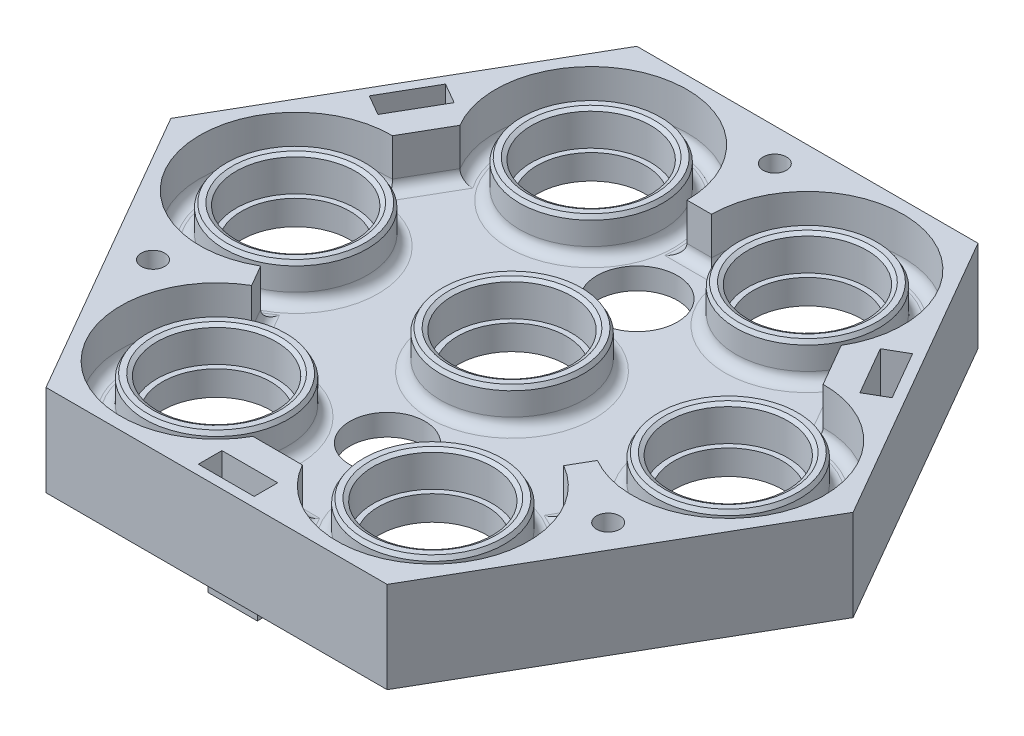
from build123d import *
from OCP.BRepFilletAPI import BRepFilletAPI_MakeChamfer

# Parameters (mm, degrees)
BOSS_EXTRUDE1_DEPTH = 28.05
BOSS_EXTRUDE2_START = -4.004
SKETCH3_R           = 10.1
BOSS_EXTRUDE2_DEPTH = 4.004
SKETCH3_3_R         = 11.1
SKETCH3_3_R_2       = 10.1
BOSS_EXTRUDE3_DEPTH = 0.6
SKETCH3_4_R         = 13.35
SKETCH3_4_R_2       = 11.1
BOSS_EXTRUDE4_DEPTH = 7
CHAMFER1_SIZE       = 0.75
CHAMFER1_SIZE2      = 0.433012702
SKETCH4_W           = 9.20093346
SKETCH4_H           = 3
BOSS_EXTRUDE5_DEPTH = 4
SKETCH5_R           = 2.175
CUT_EXTRUDE1_DEPTH  = 16.25
FILLET2_R           = 2
FILLET3_R           = 2
CUT_EXTRUDE2_DEPTH  = 87.445405368
SKETCH7_R           = 2.175
CUT_EXTRUDE3_DEPTH  = 11.05
SKETCH8_W           = 10.4
SKETCH8_H           = 4.4
CUT_EXTRUDE4_DEPTH  = 11


with BuildPart() as part:
    # Sketch1 → Boss-Extrude1 (new body)
    with BuildSketch(Plane(origin=(0, 0, 0), x_dir=(1, 0, 0), z_dir=(0, 1, 0))):
        with BuildLine():
            ThreePointArc((4.598585794, -43.670987935), (15.441921389, -52.121912551), (29.0763555, -50.361725025))
            Line((29.0763555, -50.361725025), (31.782668218, -55.049196153))
            Line((31.782668218, -55.049196153), (-31.782668218, -55.049196153))
            Line((-31.782668218, -55.049196153), (-63.565336435, 0))
            Line((-63.565336435, 0), (-58.152711, 0))
            ThreePointArc((-58.152711, 0), (-49.22575975, -15.461933122), (-31.37185725, -15.461933122))
            Line((-31.37185725, -15.461933122), (-29.0763555, -19.437858782))
            ThreePointArc((-29.0763555, -19.437858782), (-32.710456807, -47.587651973), (-4.598585794, -43.670987935))
            Line((-4.598585794, -43.670987935), (4.598585794, -43.670987935))
        make_face()
        with BuildLine():
            ThreePointArc((-40.119477858, 17.853001848), (-52.859861057, 12.687860069), (-58.152711, 0))
            Line((-58.152711, 0), (-63.565336435, 0))
            Line((-63.565336435, 0), (-31.782668218, 55.049196153))
            Line((-31.782668218, 55.049196153), (31.782668218, 55.049196153))
            Line((31.782668218, 55.049196153), (29.0763555, 50.361725025))
            ThreePointArc((29.0763555, 50.361725025), (11.222453, 50.361725025), (2.29550175, 34.899791903))
            Line((2.29550175, 34.899791903), (-2.29550175, 34.899791903))
            ThreePointArc((-2.29550175, 34.899791903), (-24.856887111, 52.121912551), (-35.520892063, 25.817986087))
            Line((-35.520892063, 25.817986087), (-40.119477858, 17.853001848))
        make_face()
        with BuildLine():
            ThreePointArc((35.520892063, 25.817986087), (37.417939668, 39.434052481), (29.0763555, 50.361725025))
            Line((29.0763555, 50.361725025), (31.782668218, 55.049196153))
            Line((31.782668218, 55.049196153), (63.565336435, 0))
            Line((63.565336435, 0), (31.782668218, -55.049196153))
            Line((31.782668218, -55.049196153), (29.0763555, -50.361725025))
            ThreePointArc((29.0763555, -50.361725025), (38.00330675, -34.899791903), (29.0763555, -19.437858782))
            Line((29.0763555, -19.437858782), (31.37185725, -15.461933122))
            ThreePointArc((31.37185725, -15.461933122), (57.567343918, -4.534260578), (40.119477858, 17.853001848))
            Line((40.119477858, 17.853001848), (35.520892063, 25.817986087))
        make_face()
    extrude(amount=-BOSS_EXTRUDE1_DEPTH)

    # Sketch3 → Boss-Extrude2 (add)
    with BuildSketch(Plane(origin=(0, -20.046, 0), x_dir=(1, 0, 0), z_dir=(0, 1, 0)).offset(BOSS_EXTRUDE2_START)):
        with BuildLine():
            Line((-31.37185725, -15.461933122), (-29.0763555, -19.437858782))
            ThreePointArc((-29.0763555, -19.437858782), (-32.710456807, -47.587651973), (-4.598585794, -43.670987935))
            Line((-4.598585794, -43.670987935), (4.598585794, -43.670987935))
            ThreePointArc((4.598585794, -43.670987935), (32.710456807, -47.587651973), (29.0763555, -19.437858782))
            Line((29.0763555, -19.437858782), (31.37185725, -15.461933122))
            ThreePointArc((31.37185725, -15.461933122), (57.567343918, -4.534260578), (40.119477858, 17.853001848))
            Line((40.119477858, 17.853001848), (35.520892063, 25.817986087))
            ThreePointArc((35.520892063, 25.817986087), (24.856887111, 52.121912551), (2.29550175, 34.899791903))
            Line((2.29550175, 34.899791903), (-2.29550175, 34.899791903))
            ThreePointArc((-2.29550175, 34.899791903), (-24.856887111, 52.121912551), (-35.520892063, 25.817986087))
            Line((-35.520892063, 25.817986087), (-40.119477858, 17.853001848))
            ThreePointArc((-40.119477858, 17.853001848), (-57.567343918, -4.534260578), (-31.37185725, -15.461933122))
        make_face()
        with Locations(Location((-20.14940425, 34.899791903, 0), (0, 0, 270))):
            Circle(SKETCH3_R, mode=Mode.SUBTRACT)
        with Locations(Location((0, 0, 0), (0, 0, 270))):
            Circle(SKETCH3_R, mode=Mode.SUBTRACT)
        with Locations(Location((20.14940425, 34.899791903, 0), (0, 0, 270))):
            Circle(SKETCH3_R, mode=Mode.SUBTRACT)
        with Locations(Location((40.2988085, 0, 0), (0, 0, 270))):
            Circle(SKETCH3_R, mode=Mode.SUBTRACT)
        with Locations(Location((20.14940425, -34.899791903, 0), (0, 0, 270))):
            Circle(SKETCH3_R, mode=Mode.SUBTRACT)
        with Locations(Location((-20.14940425, -34.899791903, 0), (0, 0, 270))):
            Circle(SKETCH3_R, mode=Mode.SUBTRACT)
        with Locations(Location((-40.2988085, 0, 0), (0, 0, 270))):
            Circle(SKETCH3_R, mode=Mode.SUBTRACT)
    extrude(amount=BOSS_EXTRUDE2_DEPTH)

    # Sketch3<3> → Boss-Extrude3 (add)
    # profile 1 of 7: a face of its own
    with BuildSketch(Plane(origin=(0, -20.046, 0), x_dir=(1, 0, 0), z_dir=(0, 1, 0))):
        with Locations(Location((0, 0, 0), (0, 0, 270))):
            Circle(SKETCH3_3_R)
        with Locations(Location((0, 0, 0), (0, 0, 270))):
            Circle(SKETCH3_3_R_2, mode=Mode.SUBTRACT)
    # profile 2 of 7: a face of its own
    with BuildSketch(Plane(origin=(0, -20.046, 0), x_dir=(1, 0, 0), z_dir=(0, 1, 0))):
        with Locations(Location((-40.2988085, 0, 0), (0, 0, 270))):
            Circle(SKETCH3_3_R)
        with Locations(Location((-40.2988085, 0, 0), (0, 0, 270))):
            Circle(SKETCH3_3_R_2, mode=Mode.SUBTRACT)
    # profile 3 of 7: a face of its own
    with BuildSketch(Plane(origin=(0, -20.046, 0), x_dir=(1, 0, 0), z_dir=(0, 1, 0))):
        with Locations(Location((-20.14940425, 34.899791903, 0), (0, 0, 270))):
            Circle(SKETCH3_3_R)
        with Locations(Location((-20.14940425, 34.899791903, 0), (0, 0, 270))):
            Circle(SKETCH3_3_R_2, mode=Mode.SUBTRACT)
    # profile 4 of 7: a face of its own
    with BuildSketch(Plane(origin=(0, -20.046, 0), x_dir=(1, 0, 0), z_dir=(0, 1, 0))):
        with Locations(Location((-20.14940425, -34.899791903, 0), (0, 0, 270))):
            Circle(SKETCH3_3_R)
        with Locations(Location((-20.14940425, -34.899791903, 0), (0, 0, 270))):
            Circle(SKETCH3_3_R_2, mode=Mode.SUBTRACT)
    # profile 5 of 7: a face of its own
    with BuildSketch(Plane(origin=(0, -20.046, 0), x_dir=(1, 0, 0), z_dir=(0, 1, 0))):
        with Locations(Location((20.14940425, -34.899791903, 0), (0, 0, 270))):
            Circle(SKETCH3_3_R)
        with Locations(Location((20.14940425, -34.899791903, 0), (0, 0, 270))):
            Circle(SKETCH3_3_R_2, mode=Mode.SUBTRACT)
    # profile 6 of 7: a face of its own
    with BuildSketch(Plane(origin=(0, -20.046, 0), x_dir=(1, 0, 0), z_dir=(0, 1, 0))):
        with Locations(Location((20.14940425, 34.899791903, 0), (0, 0, 270))):
            Circle(SKETCH3_3_R)
        with Locations(Location((20.14940425, 34.899791903, 0), (0, 0, 270))):
            Circle(SKETCH3_3_R_2, mode=Mode.SUBTRACT)
    # profile 7 of 7: a face of its own
    with BuildSketch(Plane(origin=(0, -20.046, 0), x_dir=(1, 0, 0), z_dir=(0, 1, 0))):
        with Locations(Location((40.2988085, 0, 0), (0, 0, 270))):
            Circle(SKETCH3_3_R)
        with Locations(Location((40.2988085, 0, 0), (0, 0, 270))):
            Circle(SKETCH3_3_R_2, mode=Mode.SUBTRACT)
    extrude(amount=BOSS_EXTRUDE3_DEPTH)

    # Sketch3<4> → Boss-Extrude4 (add)
    # profile 1 of 7: a face of its own
    with BuildSketch(Plane(origin=(0, -20.046, 0), x_dir=(1, 0, 0), z_dir=(0, 1, 0))):
        with Locations(Location((-40.2988085, 0, 0), (0, 0, 270))):
            Circle(SKETCH3_4_R)
        with Locations(Location((-40.2988085, 0, 0), (0, 0, 270))):
            Circle(SKETCH3_4_R_2, mode=Mode.SUBTRACT)
    # profile 2 of 7: a face of its own
    with BuildSketch(Plane(origin=(0, -20.046, 0), x_dir=(1, 0, 0), z_dir=(0, 1, 0))):
        with Locations(Location((0, 0, 0), (0, 0, 270))):
            Circle(SKETCH3_4_R)
        with Locations(Location((0, 0, 0), (0, 0, 270))):
            Circle(SKETCH3_4_R_2, mode=Mode.SUBTRACT)
    # profile 3 of 7: a face of its own
    with BuildSketch(Plane(origin=(0, -20.046, 0), x_dir=(1, 0, 0), z_dir=(0, 1, 0))):
        with Locations(Location((-20.14940425, 34.899791903, 0), (0, 0, 270))):
            Circle(SKETCH3_4_R)
        with Locations(Location((-20.14940425, 34.899791903, 0), (0, 0, 270))):
            Circle(SKETCH3_4_R_2, mode=Mode.SUBTRACT)
    # profile 4 of 7: a face of its own
    with BuildSketch(Plane(origin=(0, -20.046, 0), x_dir=(1, 0, 0), z_dir=(0, 1, 0))):
        with Locations(Location((-20.14940425, -34.899791903, 0), (0, 0, 270))):
            Circle(SKETCH3_4_R)
        with Locations(Location((-20.14940425, -34.899791903, 0), (0, 0, 270))):
            Circle(SKETCH3_4_R_2, mode=Mode.SUBTRACT)
    # profile 5 of 7: a face of its own
    with BuildSketch(Plane(origin=(0, -20.046, 0), x_dir=(1, 0, 0), z_dir=(0, 1, 0))):
        with Locations(Location((40.2988085, 0, 0), (0, 0, 270))):
            Circle(SKETCH3_4_R)
        with Locations(Location((40.2988085, 0, 0), (0, 0, 270))):
            Circle(SKETCH3_4_R_2, mode=Mode.SUBTRACT)
    # profile 6 of 7: a face of its own
    with BuildSketch(Plane(origin=(0, -20.046, 0), x_dir=(1, 0, 0), z_dir=(0, 1, 0))):
        with Locations(Location((20.14940425, -34.899791903, 0), (0, 0, 270))):
            Circle(SKETCH3_4_R)
        with Locations(Location((20.14940425, -34.899791903, 0), (0, 0, 270))):
            Circle(SKETCH3_4_R_2, mode=Mode.SUBTRACT)
    # profile 7 of 7: a face of its own
    with BuildSketch(Plane(origin=(0, -20.046, 0), x_dir=(1, 0, 0), z_dir=(0, 1, 0))):
        with Locations(Location((20.14940425, 34.899791903, 0), (0, 0, 270))):
            Circle(SKETCH3_4_R)
        with Locations(Location((20.14940425, 34.899791903, 0), (0, 0, 270))):
            Circle(SKETCH3_4_R_2, mode=Mode.SUBTRACT)
    extrude(amount=BOSS_EXTRUDE4_DEPTH)

    # Chamfer1: one chamfer whose edges measure the first distance from different faces: ONE call of the kernel's chamfer builder (chamfer() names one face for all edges)
    chamfer1_edges_1 = [part.edges().sort_by_distance(p)[0] for p in [
        (40.2988085, -13.046, -11.1),
    ]]
    chamfer1_side_1 = [part.faces().sort_by_distance(p)[0] for p in [
        (40.2988085, -13.046, -12.972404979),
    ]]
    chamfer1_edges_2 = [part.edges().sort_by_distance(p)[0] for p in [
        (40.2988085, -13.046, -13.35),
    ]]
    chamfer1_side_2 = [part.faces().sort_by_distance(p)[0] for p in [
        (40.2988085, -16.546, -13.35),
    ]]
    chamfer1_edges_3 = [part.edges().sort_by_distance(p)[0] for p in [
        (-20.14940425, -13.046, 23.799791903),
    ]]
    chamfer1_side_3 = [part.faces().sort_by_distance(p)[0] for p in [
        (-20.14940425, -13.046, 21.927386924),
    ]]
    chamfer1_edges_4 = [part.edges().sort_by_distance(p)[0] for p in [
        (-20.14940425, -13.046, 21.549791903),
    ]]
    chamfer1_side_4 = [part.faces().sort_by_distance(p)[0] for p in [
        (-20.14940425, -16.546, 21.549791903),
    ]]
    chamfer1_edges_5 = [part.edges().sort_by_distance(p)[0] for p in [
        (-20.14940425, -13.046, -45.999791903),
    ]]
    chamfer1_side_5 = [part.faces().sort_by_distance(p)[0] for p in [
        (-20.14940425, -13.046, -47.872196882),
    ]]
    chamfer1_edges_6 = [part.edges().sort_by_distance(p)[0] for p in [
        (-20.14940425, -13.046, -48.249791903),
    ]]
    chamfer1_side_6 = [part.faces().sort_by_distance(p)[0] for p in [
        (-20.14940425, -16.546, -48.249791903),
    ]]
    chamfer1_edges_7 = [part.edges().sort_by_distance(p)[0] for p in [
        (0, -13.046, -11.1),
    ]]
    chamfer1_side_7 = [part.faces().sort_by_distance(p)[0] for p in [
        (0, -13.046, -12.972404979),
    ]]
    chamfer1_edges_8 = [part.edges().sort_by_distance(p)[0] for p in [
        (0, -13.046, -13.35),
    ]]
    chamfer1_side_8 = [part.faces().sort_by_distance(p)[0] for p in [
        (0, -16.546, -13.35),
    ]]
    chamfer1_edges_9 = [part.edges().sort_by_distance(p)[0] for p in [
        (20.14940425, -13.046, 23.799791903),
    ]]
    chamfer1_side_9 = [part.faces().sort_by_distance(p)[0] for p in [
        (20.14940425, -13.046, 21.927386924),
    ]]
    chamfer1_edges_10 = [part.edges().sort_by_distance(p)[0] for p in [
        (20.14940425, -13.046, 21.549791903),
    ]]
    chamfer1_side_10 = [part.faces().sort_by_distance(p)[0] for p in [
        (20.14940425, -16.546, 21.549791903),
    ]]
    chamfer1_edges_11 = [part.edges().sort_by_distance(p)[0] for p in [
        (20.14940425, -13.046, -45.999791903),
    ]]
    chamfer1_side_11 = [part.faces().sort_by_distance(p)[0] for p in [
        (20.14940425, -13.046, -47.872196882),
    ]]
    chamfer1_edges_12 = [part.edges().sort_by_distance(p)[0] for p in [
        (20.14940425, -13.046, -48.249791903),
    ]]
    chamfer1_side_12 = [part.faces().sort_by_distance(p)[0] for p in [
        (20.14940425, -16.546, -48.249791903),
    ]]
    chamfer1_edges_13 = [part.edges().sort_by_distance(p)[0] for p in [
        (-40.2988085, -13.046, -11.1),
    ]]
    chamfer1_side_13 = [part.faces().sort_by_distance(p)[0] for p in [
        (-40.2988085, -13.046, -12.972404979),
    ]]
    chamfer1_edges_14 = [part.edges().sort_by_distance(p)[0] for p in [
        (-40.2988085, -13.046, -13.35),
    ]]
    chamfer1_side_14 = [part.faces().sort_by_distance(p)[0] for p in [
        (-40.2988085, -16.546, -13.35),
    ]]
    chamfer1 = BRepFilletAPI_MakeChamfer(part.part.solid().wrapped)
    for e in chamfer1_edges_1:
        chamfer1.Add(CHAMFER1_SIZE, CHAMFER1_SIZE2, e.wrapped, chamfer1_side_1[0].wrapped)  # the first distance lies on this face
    for e in chamfer1_edges_2:
        chamfer1.Add(CHAMFER1_SIZE, CHAMFER1_SIZE2, e.wrapped, chamfer1_side_2[0].wrapped)  # the first distance lies on this face
    for e in chamfer1_edges_3:
        chamfer1.Add(CHAMFER1_SIZE, CHAMFER1_SIZE2, e.wrapped, chamfer1_side_3[0].wrapped)  # the first distance lies on this face
    for e in chamfer1_edges_4:
        chamfer1.Add(CHAMFER1_SIZE, CHAMFER1_SIZE2, e.wrapped, chamfer1_side_4[0].wrapped)  # the first distance lies on this face
    for e in chamfer1_edges_5:
        chamfer1.Add(CHAMFER1_SIZE, CHAMFER1_SIZE2, e.wrapped, chamfer1_side_5[0].wrapped)  # the first distance lies on this face
    for e in chamfer1_edges_6:
        chamfer1.Add(CHAMFER1_SIZE, CHAMFER1_SIZE2, e.wrapped, chamfer1_side_6[0].wrapped)  # the first distance lies on this face
    for e in chamfer1_edges_7:
        chamfer1.Add(CHAMFER1_SIZE, CHAMFER1_SIZE2, e.wrapped, chamfer1_side_7[0].wrapped)  # the first distance lies on this face
    for e in chamfer1_edges_8:
        chamfer1.Add(CHAMFER1_SIZE, CHAMFER1_SIZE2, e.wrapped, chamfer1_side_8[0].wrapped)  # the first distance lies on this face
    for e in chamfer1_edges_9:
        chamfer1.Add(CHAMFER1_SIZE, CHAMFER1_SIZE2, e.wrapped, chamfer1_side_9[0].wrapped)  # the first distance lies on this face
    for e in chamfer1_edges_10:
        chamfer1.Add(CHAMFER1_SIZE, CHAMFER1_SIZE2, e.wrapped, chamfer1_side_10[0].wrapped)  # the first distance lies on this face
    for e in chamfer1_edges_11:
        chamfer1.Add(CHAMFER1_SIZE, CHAMFER1_SIZE2, e.wrapped, chamfer1_side_11[0].wrapped)  # the first distance lies on this face
    for e in chamfer1_edges_12:
        chamfer1.Add(CHAMFER1_SIZE, CHAMFER1_SIZE2, e.wrapped, chamfer1_side_12[0].wrapped)  # the first distance lies on this face
    for e in chamfer1_edges_13:
        chamfer1.Add(CHAMFER1_SIZE, CHAMFER1_SIZE2, e.wrapped, chamfer1_side_13[0].wrapped)  # the first distance lies on this face
    for e in chamfer1_edges_14:
        chamfer1.Add(CHAMFER1_SIZE, CHAMFER1_SIZE2, e.wrapped, chamfer1_side_14[0].wrapped)  # the first distance lies on this face
    add(Compound.cast(chamfer1.Shape()), mode=Mode.REPLACE)

    # Sketch4 → Boss-Extrude5 (add)
    with BuildSketch(Plane.XZ.offset(28.05)):
        Polygon((-47.37615948, -22.040477019), (-42.77569275, -30.008719134), (-40.177616539, -28.508719134), (-44.778083269, -20.540477019), align=None)
        with Locations((0, 50.549196153)):
            Rectangle(SKETCH4_W, SKETCH4_H)
        Polygon((42.77569275, -30.008719134), (47.37615948, -22.040477019), (44.778083269, -20.540477019), (40.177616539, -28.508719134), align=None)
    extrude(amount=BOSS_EXTRUDE5_DEPTH)

    # Sketch5 → Cut-Extrude1 (cut)
    with BuildSketch(Plane(origin=(0, 0, 0), x_dir=(1, 0, 0), z_dir=(0, 1, 0))):
        with Locations(Location((-42.408567872, -24.484598077, 0), (0, 0, 270))):
            Circle(SKETCH5_R)
        with Locations(Location((0, 48.969196153, 0), (0, 0, 270))):
            Circle(SKETCH5_R)
        with Locations(Location((42.408567872, -24.484598077, 0), (0, 0, 270))):
            Circle(SKETCH5_R)
    extrude(amount=-CUT_EXTRUDE1_DEPTH, mode=Mode.SUBTRACT)

    # Fillet2
    fillet2_edges = [part.edges().sort_by_distance(p)[0] for p in [
        (40.2988085, -20.046, -13.35),
        (-20.14940425, -20.046, 21.549791903),
        (-20.14940425, -20.046, -48.249791903),
        (0, -20.046, -13.35),
        (20.14940425, -20.046, 21.549791903),
        (20.14940425, -20.046, -48.249791903),
        (-40.2988085, -20.046, -13.35),
        (-30.224106375, -20.046, 17.449895952),
        (30.224106375, -20.046, 17.449895952),
        (0, -20.046, -34.899791903),
        (-24.856887111, -20.046, -52.121912551),
        (-37.820184961, -20.046, -21.835493968),
        (-57.567343918, -20.046, 4.534260578),
        (-32.710456807, -20.046, 47.587651973),
        (0, -20.046, 43.670987935),
        (32.710456807, -20.046, 47.587651973),
        (57.567343918, -20.046, 4.534260578),
        (37.820184961, -20.046, -21.835493968),
        (24.856887111, -20.046, -52.121912551),
    ]]
    fillet(fillet2_edges, radius=FILLET2_R)

    # Fillet3
    fillet3_edges = [part.edges().sort_by_distance(p)[0] for p in [
        (-30.224106375, -24.05, 17.449895952),
        (30.224106375, -24.05, 17.449895952),
        (0, -24.05, -34.899791903),
        (24.856887111, -24.05, -52.121912551),
        (37.820184961, -24.05, -21.835493968),
        (57.567343918, -24.05, 4.534260578),
        (32.710456807, -24.05, 47.587651973),
        (0, -24.05, 43.670987935),
        (-32.710456807, -24.05, 47.587651973),
        (-57.567343918, -24.05, 4.534260578),
        (-37.820184961, -24.05, -21.835493968),
        (-24.856887111, -24.05, -52.121912551),
    ]]
    fillet(fillet3_edges, radius=FILLET3_R)

    # Sketch6 → Cut-Extrude2 (cut, through all)
    with BuildSketch(Plane(origin=(0, -20.046, 0), x_dir=(1, 0, 0), z_dir=(0, 1, 0))):
        with BuildLine():
            ThreePointArc((7, -23.212196153), (4.949747468, -18.262448685), (0, -16.212196153))
            Line((0, -16.212196153), (0, -30.212196153))
            ThreePointArc((0, -30.212196153), (4.949747468, -28.161943622), (7, -23.212196153))
        make_face()
        with BuildLine():
            Line((0, -30.212196153), (0, -16.212196153))
            ThreePointArc((0, -16.212196153), (-7, -23.212196153), (0, -30.212196153))
        make_face()
        with BuildLine():
            ThreePointArc((7.5, 23.322196153), (5.303300859, 28.625497012), (0, 30.822196153))
            Line((0, 30.822196153), (0, 15.822196153))
            ThreePointArc((0, 15.822196153), (5.303300859, 18.018895294), (7.5, 23.322196153))
        make_face()
        with BuildLine():
            Line((0, 15.822196153), (0, 30.822196153))
            ThreePointArc((0, 30.822196153), (-7.5, 23.322196153), (0, 15.822196153))
        make_face()
    extrude(amount=-CUT_EXTRUDE2_DEPTH, mode=Mode.SUBTRACT)

    # Sketch7 → Cut-Extrude3 (cut)
    with BuildSketch(Plane(origin=(0, 0, 0), x_dir=(1, 0, 0), z_dir=(0, 1, 0))):
        Polygon((-63.565336435, 0), (-31.782668218, 55.049196153), (31.782668218, 55.049196153), (63.565336435, 0), (31.782668218, -55.049196153), (-31.782668218, -55.049196153), align=None)
        with Locations(Location((42.408567872, -24.484598077, 0), (0, 0, 270))):
            Circle(SKETCH7_R, mode=Mode.SUBTRACT)
        with Locations(Location((0, 48.969196153, 0), (0, 0, 270))):
            Circle(SKETCH7_R, mode=Mode.SUBTRACT)
        with Locations(Location((-42.408567872, -24.484598077, 0), (0, 0, 270))):
            Circle(SKETCH7_R, mode=Mode.SUBTRACT)
        with BuildLine():
            Line((-2.29550175, 34.899791903), (2.29550175, 34.899791903))
            ThreePointArc((2.29550175, 34.899791903), (24.856887111, 52.121912551), (35.520892063, 25.817986087))
            Line((35.520892063, 25.817986087), (40.119477858, 17.853001848))
            ThreePointArc((40.119477858, 17.853001848), (57.567343918, -4.534260578), (31.37185725, -15.461933122))
            Line((31.37185725, -15.461933122), (29.0763555, -19.437858782))
            ThreePointArc((29.0763555, -19.437858782), (32.710456807, -47.587651973), (4.598585794, -43.670987935))
            Line((4.598585794, -43.670987935), (-4.598585794, -43.670987935))
            ThreePointArc((-4.598585794, -43.670987935), (-32.710456807, -47.587651973), (-29.0763555, -19.437858782))
            Line((-29.0763555, -19.437858782), (-31.37185725, -15.461933122))
            ThreePointArc((-31.37185725, -15.461933122), (-57.567343918, -4.534260578), (-40.119477858, 17.853001848))
            Line((-40.119477858, 17.853001848), (-35.520892063, 25.817986087))
            ThreePointArc((-35.520892063, 25.817986087), (-24.856887111, 52.121912551), (-2.29550175, 34.899791903))
        make_face(mode=Mode.SUBTRACT)
    extrude(amount=-CUT_EXTRUDE3_DEPTH, mode=Mode.SUBTRACT)

    # Sketch8 → Cut-Extrude4 (cut)
    with BuildSketch(Plane(origin=(0, -11.05, 0), x_dir=(1, 0, 0), z_dir=(0, 1, 0))):
        with Locations((0, -51.049196153)):
            Rectangle(SKETCH8_W, SKETCH8_H)
        Polygon((-39.704644823, 28.927930176), (-43.5151566, 31.127930176), (-48.7151566, 22.121265977), (-44.904644823, 19.921265977), align=None)
        Polygon((44.904644823, 19.921265977), (48.7151566, 22.121265977), (43.5151566, 31.127930176), (39.704644823, 28.927930176), align=None)
    extrude(amount=-CUT_EXTRUDE4_DEPTH, mode=Mode.SUBTRACT)


solid = part.part
